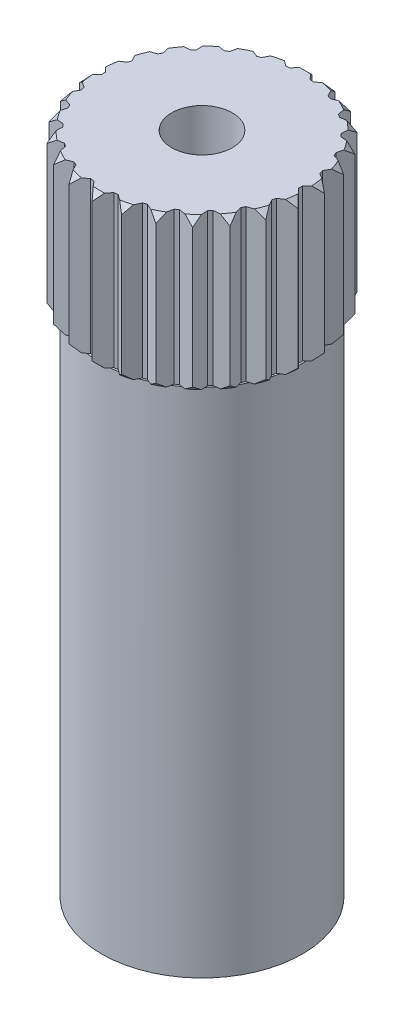
from build123d import *

# Parameters (mm, degrees)
SHAFTS_R              = 2.9
SHAFT_DEPTH           = 13.5
SHAFTEXTENSIONS_R     = 2.6
SHAFT_EXTENSION_DEPTH = 4
TOOTH_REACH           = 19.974
TOOTH_CP_COUNT        = 26
SMALLBORES_R          = 0.8
SMALL_BORE_DEPTH      = 4
SHAFTUNDERCUTS_W      = 0.25
SHAFTUNDERCUTS_H      = 13.5


with BuildPart() as part:
    # ShaftS → SHAFT (new body)
    with BuildSketch(Plane(origin=(0, 0, 0), x_dir=(1, 0, 0), z_dir=(0, 1, 0))):
        with Locations(Location((0, 0, 0), (0, 0, 270))):
            Circle(SHAFTS_R)
    extrude(amount=SHAFT_DEPTH)

    # ShaftExtensionS → SHAFT EXTENSION (add)
    with BuildSketch(Plane(origin=(0, 13.5, 0), x_dir=(1, 0, 0), z_dir=(0, 1, 0))):
        with Locations(Location((0, 0, 0), (0, 0, 270))):
            Circle(SHAFTEXTENSIONS_R)
    extrude(amount=SHAFT_EXTENSION_DEPTH)

    # ToothS → TOOTH (add, up to next)
    with BuildSketch(Plane(origin=(0, 17.5, 0), x_dir=(1, 0, 0), z_dir=(0, 1, 0)), mode=Mode.PRIVATE) as tooth_sk1:
        with BuildLine():
            Line((0, 2.9), (-0.262912611, 2.586672952))
            ThreePointArc((-0.262912611, 2.586672952), (0, 2.6), (0.262912611, 2.586672952))
            Line((0.262912611, 2.586672952), (0, 2.9))
        make_face()
    tooth_tool1 = extrude(tooth_sk1.sketch, amount=-TOOTH_REACH, mode=Mode.PRIVATE) - part.part
    tooth = tooth_tool1.solids().sort_by_distance((0, 17.5, -2.697077))[0]
    add(tooth)

    # TOOTH CP: TOOTH ×26 about axis
    tooth_cp_axis = Axis((0, 0, 0), (0, 1, 0))
    for i in range(1, TOOTH_CP_COUNT):
        add(tooth.rotate(tooth_cp_axis, i * 360 / TOOTH_CP_COUNT))

    # SmallBoreS → SMALL BORE (cut)
    with BuildSketch(Plane(origin=(0, 17.5, 0), x_dir=(1, 0, 0), z_dir=(0, 1, 0))):
        with Locations(Location((0, 0, 0), (0, 0, 270))):
            Circle(SMALLBORES_R)
    extrude(amount=-SMALL_BORE_DEPTH, mode=Mode.SUBTRACT)

    # ShaftUnderCutS → SHAFT UNDER CUT (revolve, cut)
    with BuildSketch(Plane.XY, mode=Mode.PRIVATE) as shaft_under_cut_sk:
        with Locations((2.775, 6.75)):
            Rectangle(SHAFTUNDERCUTS_W, SHAFTUNDERCUTS_H)
    revolve(shaft_under_cut_sk.sketch.rotate(Axis((0, 13.5, 0), (0, -1, 0)), 90), axis=Axis((0, 13.5, 0), (0, -1, 0)), mode=Mode.SUBTRACT)

    # TeethChamferS → TEETH CHAMFER (revolve, cut)
    with BuildSketch(Plane(origin=(0, 0, 0), x_dir=(0, 0, -1), z_dir=(1, 0, 0))):
        Polygon((2.9, 17.323223305), (2.9, 17.5), (2.723223305, 17.5), align=None)
        Polygon((2.723223305, 13.5), (2.9, 13.676776695), (2.9, 13.5), align=None)
    revolve(axis=Axis((0, 13.5, 0), (0, 1, 0)), mode=Mode.SUBTRACT)


solid = part.part
